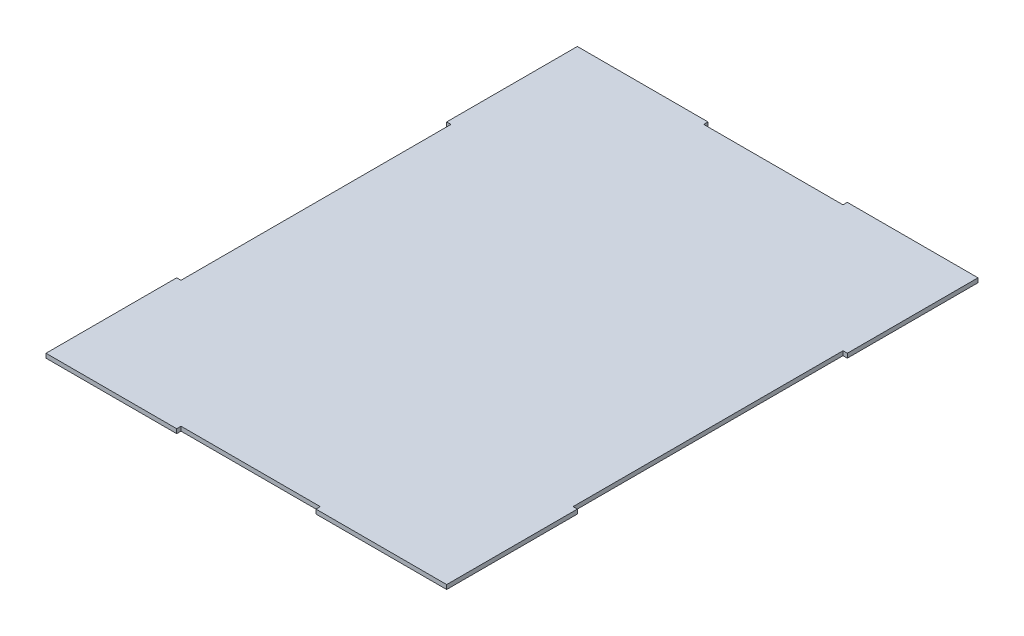
from build123d import *

# Parameters (mm, degrees)
SALIENTE_EXTRUIR1_DEPTH = 3.3


with BuildPart() as part:
    # Croquis1 → Saliente-Extruir1 (new body)
    with BuildSketch(Plane(origin=(0, 0, 0), x_dir=(1, 0, 0), z_dir=(0, 1, 0))):
        Polygon((53.3, 200), (-53.3, 200), (-53.3, 203.3), (-153.3, 203.3), (-153.3, 103.3), (-150, 103.3), (-150, -103.3), (-153.3, -103.3), (-153.3, -200), (-153.3, -203.3), (-53.3, -203.3), (-53.3, -200), (53.3, -200), (53.3, -203.3), (153.3, -203.3), (153.3, -200), (153.3, -103.3), (150, -103.3), (150, 103.3), (153.3, 103.3), (153.3, 203.3), (150, 203.3), (53.3, 203.3), align=None)
    extrude(amount=SALIENTE_EXTRUIR1_DEPTH)


solid = part.part
